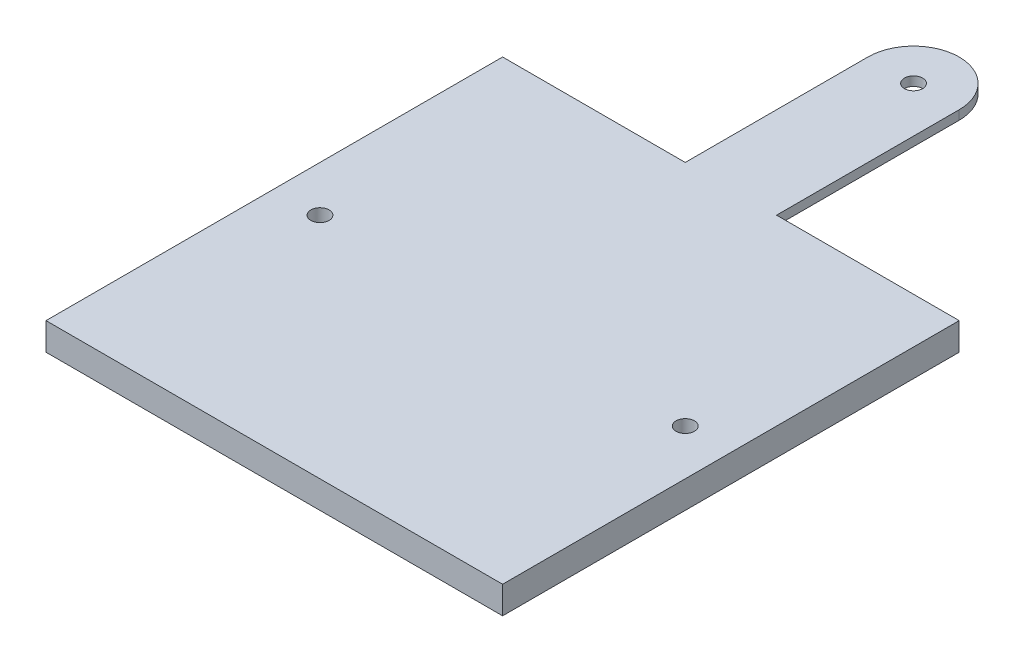
from build123d import *

# Parameters (mm, degrees)
SKETCH1_R           = 10
BOSS_EXTRUDE1_DEPTH = 10
SKETCH2_W           = 500
SKETCH2_H           = 500
BOSS_EXTRUDE2_DEPTH = 20
SKETCH3_R           = 10
CUT_EXTRUDE1_DEPTH  = 744.908596536


with BuildPart() as part:
    # Sketch1 → Boss-Extrude1 (new body)
    with BuildSketch(Plane(origin=(0, 0, 0), x_dir=(1, 0, 0), z_dir=(0, 1, 0))):
        with BuildLine():
            Line((-50, 0), (-50, -200))
            Line((-50, -200), (-250, -200))
            Line((-250, -200), (-250, -700))
            Line((-250, -700), (250, -700))
            Line((250, -700), (250, -200))
            Line((250, -200), (50, -200))
            Line((50, -200), (50, 0))
            ThreePointArc((50, 0), (0, 50), (-50, 0))
        make_face()
        with Locations(Location((0, 0, 0), (0, 0, 270))):
            Circle(SKETCH1_R, mode=Mode.SUBTRACT)
    extrude(amount=BOSS_EXTRUDE1_DEPTH)

    # Sketch2 → Boss-Extrude2 (add)
    with BuildSketch(Plane.XZ):
        with Locations((0, 450)):
            Rectangle(SKETCH2_W, SKETCH2_H)
    extrude(amount=BOSS_EXTRUDE2_DEPTH)

    # Sketch3 → Cut-Extrude1 (cut, through all)
    with BuildSketch(Plane(origin=(0, 10, 0), x_dir=(1, 0, 0), z_dir=(0, 1, 0))):
        with Locations(Location((200, -450, 0), (0, 0, 270))):
            Circle(SKETCH3_R)
        with Locations(Location((-200, -450, 0), (0, 0, 90))):
            Circle(SKETCH3_R)
    extrude(amount=-CUT_EXTRUDE1_DEPTH, mode=Mode.SUBTRACT)


solid = part.part
